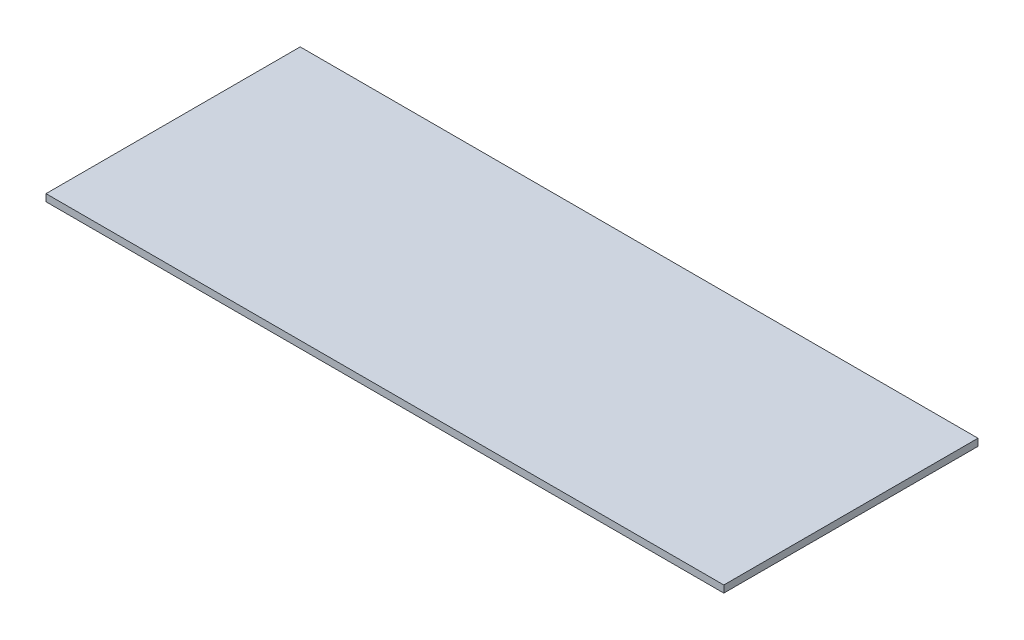
from build123d import *

# Parameters (mm, degrees)
SKETCH1_W           = 609.6
SKETCH1_H           = 228.6
BOSS_EXTRUDE1_DEPTH = 6.35


with BuildPart() as part:
    # Sketch1 → Boss-Extrude1 (new body)
    with BuildSketch(Plane(origin=(0, 0, 0), x_dir=(1, 0, 0), z_dir=(0, 1, 0))):
        Rectangle(SKETCH1_W, SKETCH1_H)
    extrude(amount=BOSS_EXTRUDE1_DEPTH)


solid = part.part
